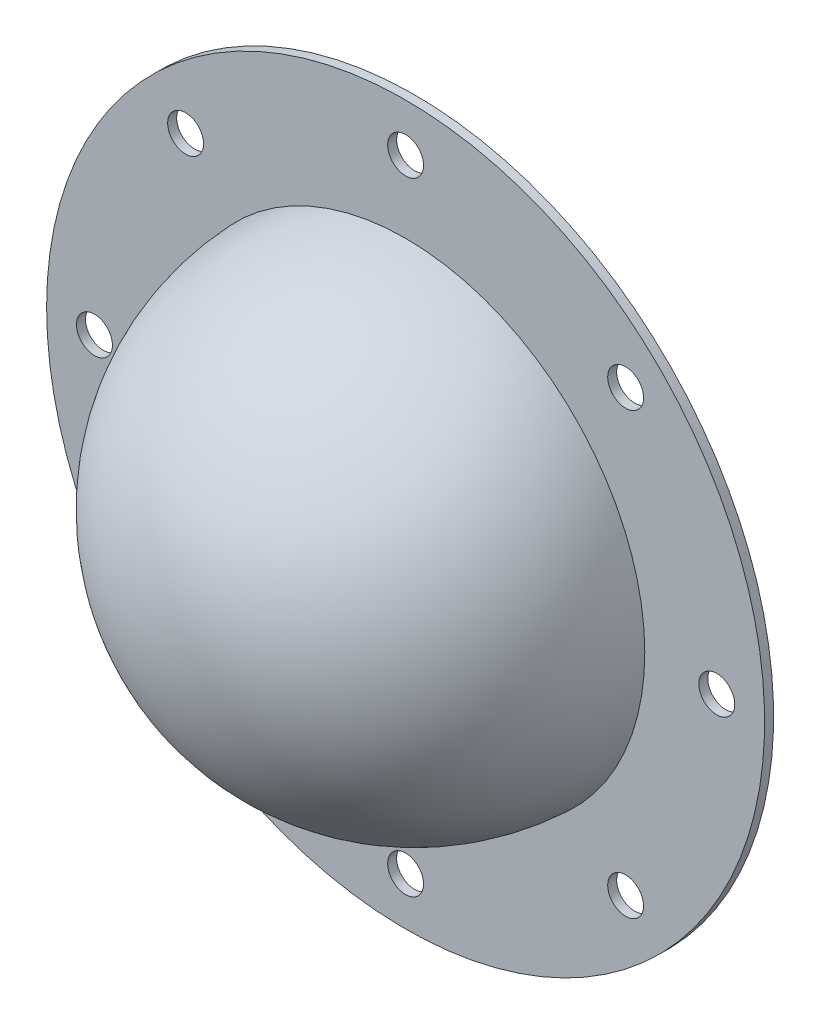
from build123d import *

# Parameters (mm, degrees)
SKETCH_2_R               = 101.541015805
CUT_EXTRUDE_1_DEPTH      = 92
SKETCH_4_R               = 60
SKETCH_4_R_2             = 39
EXTRUDE_1_DEPTH          = 1.5
SKETCH_5_W               = 2
SKETCH_5_H               = 2
SKETCH_6_R               = 3
CUT_EXTRUDE_2_DEPTH      = 20
PATTERN_CIRCULAR_1_COUNT = 8


with BuildPart() as part:
    # 草图1 → 旋转1 (revolve)
    with BuildSketch(Plane(origin=(0, 0, 0), x_dir=(0, 0, -1), z_dir=(1, 0, 0))):
        with BuildLine():
            Line((-40, 0), (40, 0))
            ThreePointArc((40, 0), (0, 40), (-40, 0))
        make_face()
    revolve(axis=Axis((0, 0, 40), (0, 0, -1)))

    # 草图2 → 切除-拉伸1 (cut)
    with BuildSketch(Plane.XY):
        with Locations((-18.762206379, 13.237665106)):
            Circle(SKETCH_2_R)
    extrude(amount=-CUT_EXTRUDE_1_DEPTH, mode=Mode.SUBTRACT)

    # 草图3 → 切除-旋转1 (revolve, cut)
    with BuildSketch(Plane(origin=(0, 0, 0), x_dir=(1, 0, 0), z_dir=(0, 1, 0))):
        with BuildLine():
            Line((0, 38.5), (0, -38.5))
            ThreePointArc((0, -38.5), (38.5, 0), (0, 38.5))
        make_face()
    revolve(axis=Axis((0, 0, -38.5), (0, 0, 1)), mode=Mode.SUBTRACT)

    # 草图4 → 凸台-拉伸1 (add)
    with BuildSketch(Plane(origin=(0, 0, 0), x_dir=(-1, 0, 0), z_dir=(0, 0, -1))):
        Circle(SKETCH_4_R)
        Circle(SKETCH_4_R_2, mode=Mode.SUBTRACT)
    extrude(amount=-EXTRUDE_1_DEPTH)

    # 草图5 → 旋转2 (revolve)
    with BuildSketch(Plane(origin=(0, 0, 0), x_dir=(1, 0, 0), z_dir=(0, 1, 0)), mode=Mode.PRIVATE) as revolve_2_sk:
        with Locations((-44, 1)):
            Rectangle(SKETCH_5_W, SKETCH_5_H)
    revolve(revolve_2_sk.sketch.rotate(Axis((0, 0, -24.660694069), (0, 0, 1)), 270), axis=Axis((0, 0, -24.660694069), (0, 0, 1)))

    # 草图6 → 切除-拉伸2 (cut)
    with BuildSketch(Plane.XY.offset(1.5)):
        with Locations((52, 0)):
            Circle(SKETCH_6_R)
    cut_extrude_2 = extrude(amount=-CUT_EXTRUDE_2_DEPTH, mode=Mode.SUBTRACT)

    # 阵列(圆周)1: 切除-拉伸2 ×8 about axis
    pattern_circular_1_axis = Axis((0, 0, 0), (0, 0, 1))
    for i in range(1, PATTERN_CIRCULAR_1_COUNT):
        add(cut_extrude_2.rotate(pattern_circular_1_axis, i * 360 / PATTERN_CIRCULAR_1_COUNT), mode=Mode.SUBTRACT)


solid = part.part
